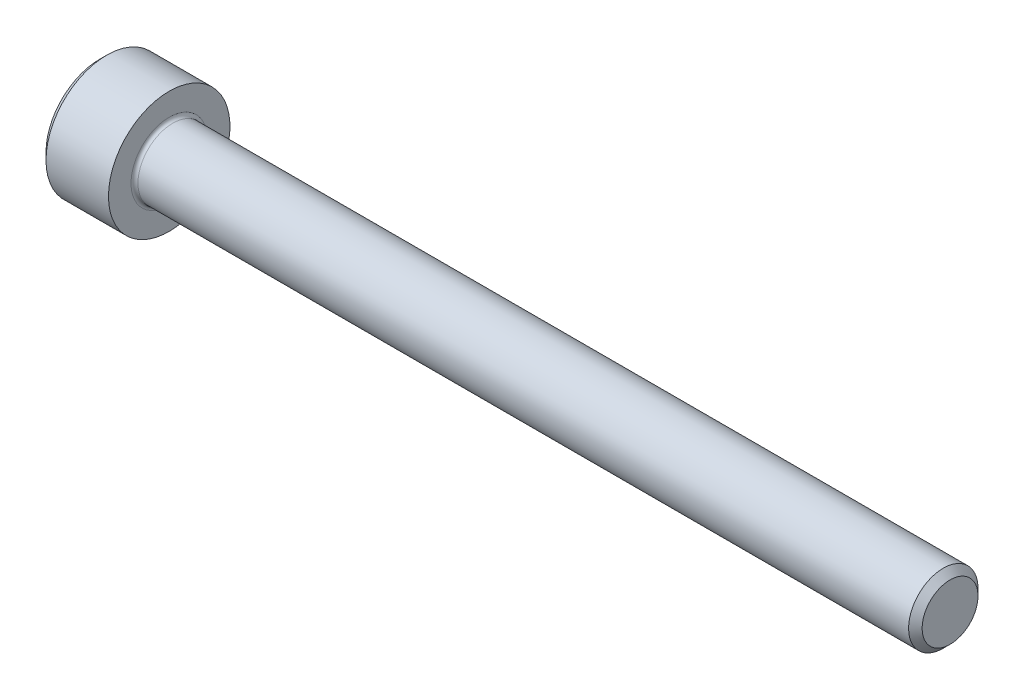
from build123d import *

# Parameters (mm, degrees)
FILLET1_R   = 0.2
HEX_2_DEPTH = 2


with BuildPart() as part:
    # BodySke → Base-Revolve (revolve)
    with BuildSketch(Plane.XY, mode=Mode.PRIVATE) as base_revolve_sk:
        Polygon((0, 0), (0, 3.1), (0.4, 3.5), (4, 3.5), (4, 2), (48.61, 2), (49, 1.61), (49, 0), align=None)
    revolve(base_revolve_sk.sketch.rotate(Axis((-31.75, 0, 0), (1, 0, 0)), 90), axis=Axis((-31.75, 0, 0), (1, 0, 0)))

    # Fillet1
    fillet1_edges = [part.edges().sort_by_distance(p)[0] for p in [
        (4, 0, -2),
    ]]
    fillet(fillet1_edges, radius=FILLET1_R)

    # Sketch2 → Hex-PreBroach (revolve, cut)
    with BuildSketch(Plane.XY, mode=Mode.PRIVATE) as hex_prebroach_sk:
        Polygon((0, 1.5355), (2, 1.5355), (2.886521338, 0), (0, 0), align=None)
    revolve(hex_prebroach_sk.sketch.rotate(Axis((0, 0, 0), (1, 0, 0)), 90), axis=Axis((0, 0, 0), (1, 0, 0)), mode=Mode.SUBTRACT)

    # Sketch3 → Hex 2 (cut)
    with BuildSketch(Plane(origin=(0, 0, 0), x_dir=(0, 0.500000000000001, 0.866025403784438), z_dir=(-1, 0, 0))):
        Polygon((0.886521338, 1.5355), (-0.886521338, 1.5355), (-1.773042677, 0), (-0.886521338, -1.5355), (0.886521338, -1.5355), (1.773042677, 0), align=None)
    extrude(amount=-HEX_2_DEPTH, mode=Mode.SUBTRACT)


solid = part.part
